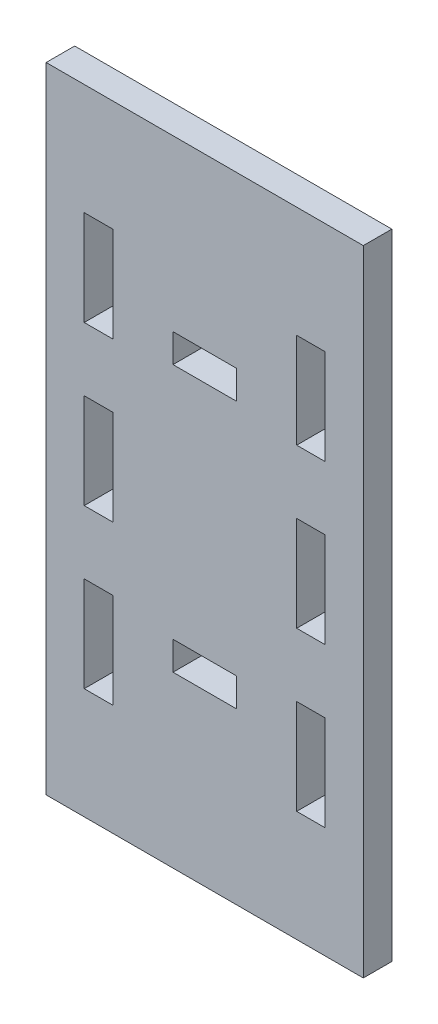
from build123d import *

# Parameters (mm, degrees)
MODEL_W             = 100
MODEL_H             = 200
MODEL_W_2           = 20
MODEL_H_2           = 9
MODEL_W_3           = 9
MODEL_H_3           = 30
BOSS_EXTRUDE1_DEPTH = 9


with BuildPart() as part:
    # Model → Boss-Extrude1 (new body)
    with BuildSketch(Plane.XY):
        with Locations((50, 100)):
            Rectangle(MODEL_W, MODEL_H)
        with Locations((50, 58)):
            Rectangle(MODEL_W_2, MODEL_H_2, mode=Mode.SUBTRACT)
        with Locations((50, 142)):
            Rectangle(MODEL_W_2, MODEL_H_2, mode=Mode.SUBTRACT)
        with Locations((16.5, 150)):
            Rectangle(MODEL_W_3, MODEL_H_3, mode=Mode.SUBTRACT)
        with Locations((16.5, 100)):
            Rectangle(MODEL_W_3, MODEL_H_3, mode=Mode.SUBTRACT)
        with Locations((16.5, 50)):
            Rectangle(MODEL_W_3, MODEL_H_3, mode=Mode.SUBTRACT)
        with Locations((83.5, 50)):
            Rectangle(MODEL_W_3, MODEL_H_3, mode=Mode.SUBTRACT)
        with Locations((83.5, 100)):
            Rectangle(MODEL_W_3, MODEL_H_3, mode=Mode.SUBTRACT)
        with Locations((83.5, 150)):
            Rectangle(MODEL_W_3, MODEL_H_3, mode=Mode.SUBTRACT)
    extrude(amount=BOSS_EXTRUDE1_DEPTH)


solid = part.part
